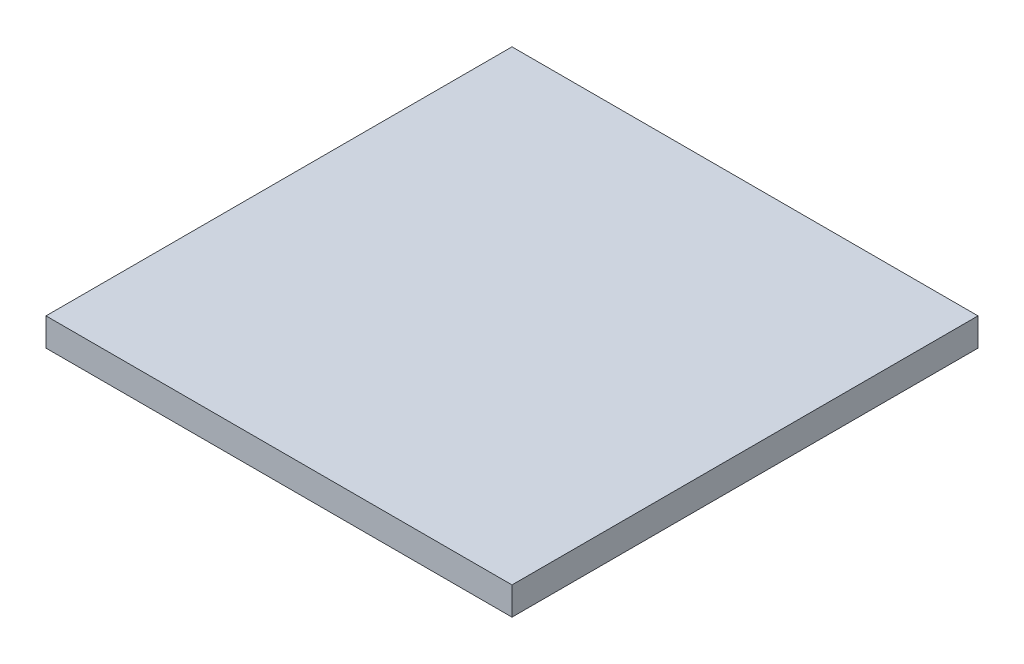
from build123d import *

# Parameters (mm, degrees)
SKETCH1_W     = 500
SKETCH1_H     = 30
PROFILE_DEPTH = 500


with BuildPart() as part:
    # Sketch1 → Profile (new body)
    with BuildSketch(Plane.XY):
        with Locations((250, 15)):
            Rectangle(SKETCH1_W, SKETCH1_H)
    extrude(amount=PROFILE_DEPTH)


solid = part.part
